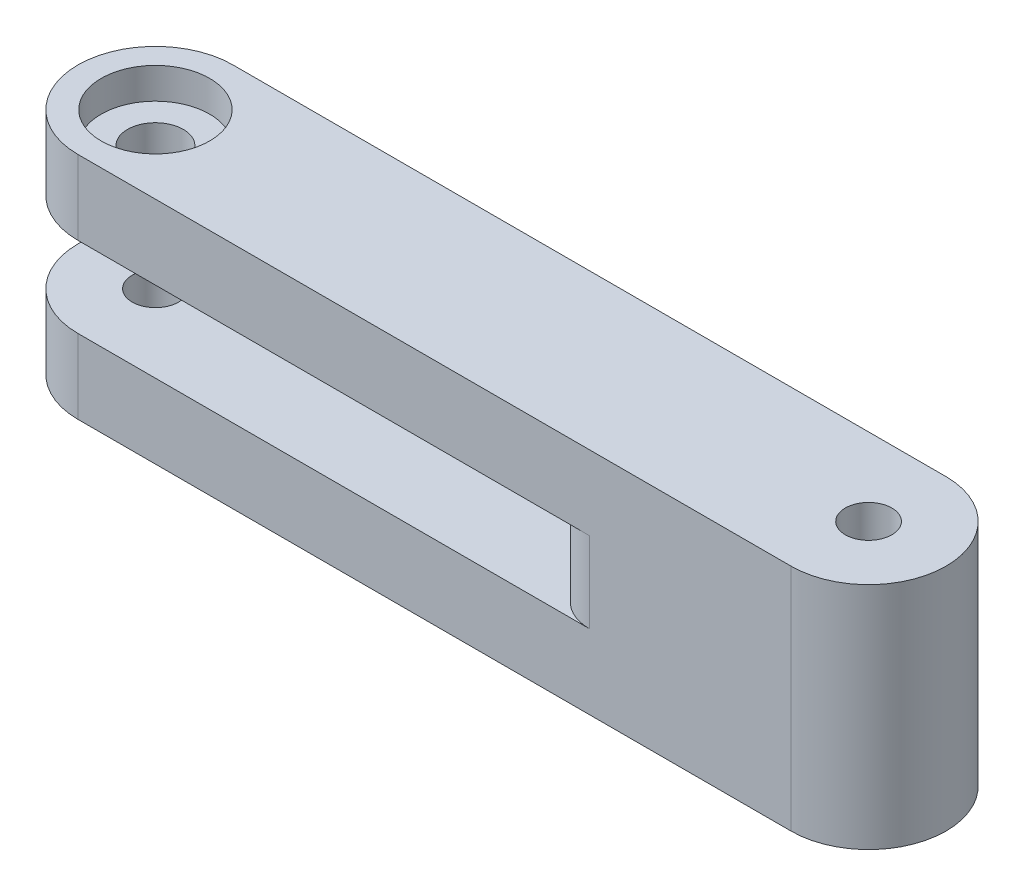
from build123d import *

# Parameters (mm, degrees)
SKETCH1_R           = 2.286
SKETCH1_R_2         = 1.905
BOSS_EXTRUDE1_DEPTH = 18.796
SKETCH2_W           = 44.45
SKETCH2_H           = 6.604
CUT_EXTRUDE1_DEPTH  = 43.179298429
SKETCH3_R           = 4.445
CUT_EXTRUDE2_DEPTH  = 2.54
BOSS_EXTRUDE2_START = -6.096
SKETCH4_R           = 2.286
SKETCH4_R_2         = 1.905
BOSS_EXTRUDE2_DEPTH = 6.096
FILLET1_R           = 3.81


with BuildPart() as part:
    # Sketch1 → Boss-Extrude1 (new body)
    with BuildSketch(Plane(origin=(0, 0, 0), x_dir=(1, 0, 0), z_dir=(0, 1, 0))):
        with BuildLine():
            Line((-29.21, 6.35), (29.21, 6.35))
            ThreePointArc((29.21, 6.35), (35.56, 0), (29.21, -6.35))
            Line((29.21, -6.35), (-29.21, -6.35))
            ThreePointArc((-29.21, -6.35), (-35.56, 0), (-29.21, 6.35))
        make_face()
        with Locations(Location((-29.21, 0, 0), (0, 0, 270))):
            Circle(SKETCH1_R, mode=Mode.SUBTRACT)
        with Locations(Location((29.21, 0, 0), (0, 0, 270))):
            Circle(SKETCH1_R_2, mode=Mode.SUBTRACT)
    extrude(amount=BOSS_EXTRUDE1_DEPTH)

    # Sketch2 → Cut-Extrude1 (cut, through all)
    with BuildSketch(Plane.XY.offset(6.35)):
        with Locations((-13.335, 9.398)):
            Rectangle(SKETCH2_W, SKETCH2_H)
    extrude(amount=-CUT_EXTRUDE1_DEPTH, mode=Mode.SUBTRACT)

    # Sketch3 → Cut-Extrude2 (cut)
    with BuildSketch(Plane(origin=(0, 18.796, 0), x_dir=(1, 0, 0), z_dir=(0, 1, 0))):
        with Locations(Location((-29.21, 0, 0), (0, 0, 270))):
            Circle(SKETCH3_R)
    extrude(amount=-CUT_EXTRUDE2_DEPTH, mode=Mode.SUBTRACT)

    # Sketch4 → Boss-Extrude2 (add)
    with BuildSketch(Plane(origin=(0, 6.096, 0), x_dir=(1, 0, 0), z_dir=(0, 1, 0)).offset(BOSS_EXTRUDE2_START)):
        with Locations(Location((-29.21, 0, 0), (0, 0, 270))):
            Circle(SKETCH4_R)
        with Locations(Location((-29.21, 0, 0), (0, 0, 180))):
            Circle(SKETCH4_R_2, mode=Mode.SUBTRACT)
    extrude(amount=BOSS_EXTRUDE2_DEPTH)

    # Fillet1
    fillet1_edges = [part.edges().sort_by_distance(p)[0] for p in [
        (8.89, 9.398, 6.35),
        (8.89, 9.398, -6.35),
    ]]
    fillet(fillet1_edges, radius=FILLET1_R)


solid = part.part
